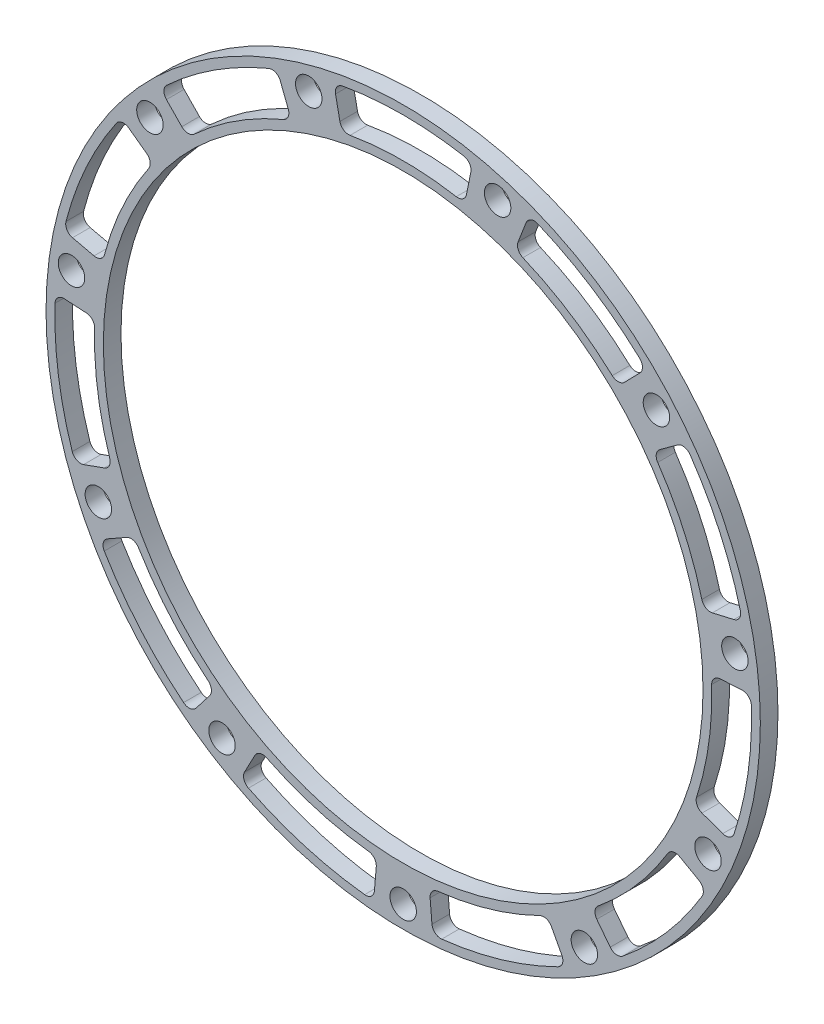
from build123d import *

# Parameters (mm, degrees)
SKETCH_1_R                       = 40.5
SKETCH_1_R_2                     = 34
SKETCH_1_R_3                     = 1.5
EXTRUDE_1_DEPTH                  = 2
CUT_EXTRUDE_1_DEPTH              = 58.310557492
FILLET_1_R                       = 1
PATTERN_CIRCULAR_1_COUNT         = 11
FILLET_1_OF_PATTERN_CIRCULAR_1_R = 1


with BuildPart() as part:
    # 草图1 → 凸台-拉伸1 (new body)
    with BuildSketch(Plane.XY):
        Circle(SKETCH_1_R)
        Circle(SKETCH_1_R_2, mode=Mode.SUBTRACT)
        with Locations((0, -38)):
            Circle(SKETCH_1_R_3, mode=Mode.SUBTRACT)
        with Locations((-20.544351063, -31.967634248)):
            Circle(SKETCH_1_R_3, mode=Mode.SUBTRACT)
        with Locations((-34.566015823, -15.785770494)):
            Circle(SKETCH_1_R_3, mode=Mode.SUBTRACT)
        with Locations((-37.613214791, 5.407963854)):
            Circle(SKETCH_1_R_3, mode=Mode.SUBTRACT)
        with Locations((-28.718483825, 24.88470789)):
            Circle(SKETCH_1_R_3, mode=Mode.SUBTRACT)
        with Locations((-10.70583716, 36.460732997)):
            Circle(SKETCH_1_R_3, mode=Mode.SUBTRACT)
        with Locations((10.70583716, 36.460732997)):
            Circle(SKETCH_1_R_3, mode=Mode.SUBTRACT)
        with Locations((28.718483825, 24.88470789)):
            Circle(SKETCH_1_R_3, mode=Mode.SUBTRACT)
        with Locations((37.613214791, 5.407963854)):
            Circle(SKETCH_1_R_3, mode=Mode.SUBTRACT)
        with Locations((34.566015823, -15.785770494)):
            Circle(SKETCH_1_R_3, mode=Mode.SUBTRACT)
        with Locations((20.544351063, -31.967634248)):
            Circle(SKETCH_1_R_3, mode=Mode.SUBTRACT)
    extrude(amount=EXTRUDE_1_DEPTH)

    # 草图2 → 切除-拉伸1 (cut, through all)
    with BuildSketch(Plane.XY.offset(2)):
        with BuildLine():
            Line((-7.875033409, 38.707025833), (-6.977877705, 34.297364662))
            ThreePointArc((-6.977877705, 34.297364662), (0, 35), (6.977877705, 34.297364662))
            Line((6.977877705, 34.297364662), (7.875033409, 38.707025833))
            ThreePointArc((7.875033409, 38.707025833), (0, 39.5), (-7.875033409, 38.707025833))
        make_face()
    cut_extrude_1 = extrude(amount=-CUT_EXTRUDE_1_DEPTH, mode=Mode.SUBTRACT)

    # 圆角1
    fillet_1_edges = [part.edges().sort_by_distance(p)[0] for p in [
        (7.875033409, 38.707025833, 1),
        (6.977877705, 34.297364662, 1),
        (-6.977877705, 34.297364662, 1),
        (-7.875033409, 38.707025833, 1),
    ]]
    fillet(fillet_1_edges, radius=FILLET_1_R)

    # 阵列(圆周)1: 切除-拉伸1 ×11 about axis
    pattern_circular_1_axis = Axis((0, 0, 2), (0, 0, -1))
    for i in range(1, PATTERN_CIRCULAR_1_COUNT):
        add(cut_extrude_1.rotate(pattern_circular_1_axis, i * 360 / PATTERN_CIRCULAR_1_COUNT), mode=Mode.SUBTRACT)

    # 圆角1 of 阵列(圆周)1
    fillet_1_of_pattern_circular_1_edges = [part.edges().sort_by_distance(p)[0] for p in [
        (27.551497764, 28.304857727, 1),
        (24.412719538, 25.080253682, 1),
        (12.672390997, 32.625304695, 1),
        (14.30169841, 36.819986727, 1),
        (38.480556248, 8.916097286, 1),
        (34.09669541, 7.900339367, 1),
        (28.299265095, 20.594941007, 1),
        (31.937742036, 23.242861993, 1),
        (37.192310014, -13.303461046, 1),
        (32.955211405, -11.787876876, 1),
        (34.941322479, 2.025829066, 1),
        (39.433778227, 2.286292803, 1),
        (24.095768139, -31.299264493, 1),
        (21.35068063, -27.7335255, 1),
        (30.48975686, -17.18646929, 1),
        (34.409868456, -19.396158198, 1),
        (3.348990132, -39.357772613, 1),
        (2.967459611, -34.873975733, 1),
        (16.357908867, -30.942185079, 1),
        (18.461068579, -34.920466018, 1),
        (-18.461068579, -34.920466018, 1),
        (-16.357908867, -30.942185079, 1),
        (-2.967459611, -34.873975733, 1),
        (-3.348990132, -39.357772613, 1),
        (-34.409868456, -19.396158198, 1),
        (-30.48975686, -17.18646929, 1),
        (-21.35068063, -27.7335255, 1),
        (-24.095768139, -31.299264493, 1),
        (-39.433778227, 2.286292803, 1),
        (-34.941322479, 2.025829066, 1),
        (-32.955211405, -11.787876876, 1),
        (-37.192310014, -13.303461046, 1),
        (-31.937742036, 23.242861993, 1),
        (-28.299265095, 20.594941007, 1),
        (-34.09669541, 7.900339367, 1),
        (-38.480556248, 8.916097286, 1),
        (-14.30169841, 36.819986727, 1),
        (-12.672390997, 32.625304695, 1),
        (-24.412719538, 25.080253682, 1),
        (-27.551497764, 28.304857727, 1),
    ]]
    fillet(fillet_1_of_pattern_circular_1_edges, radius=FILLET_1_OF_PATTERN_CIRCULAR_1_R)


solid = part.part
